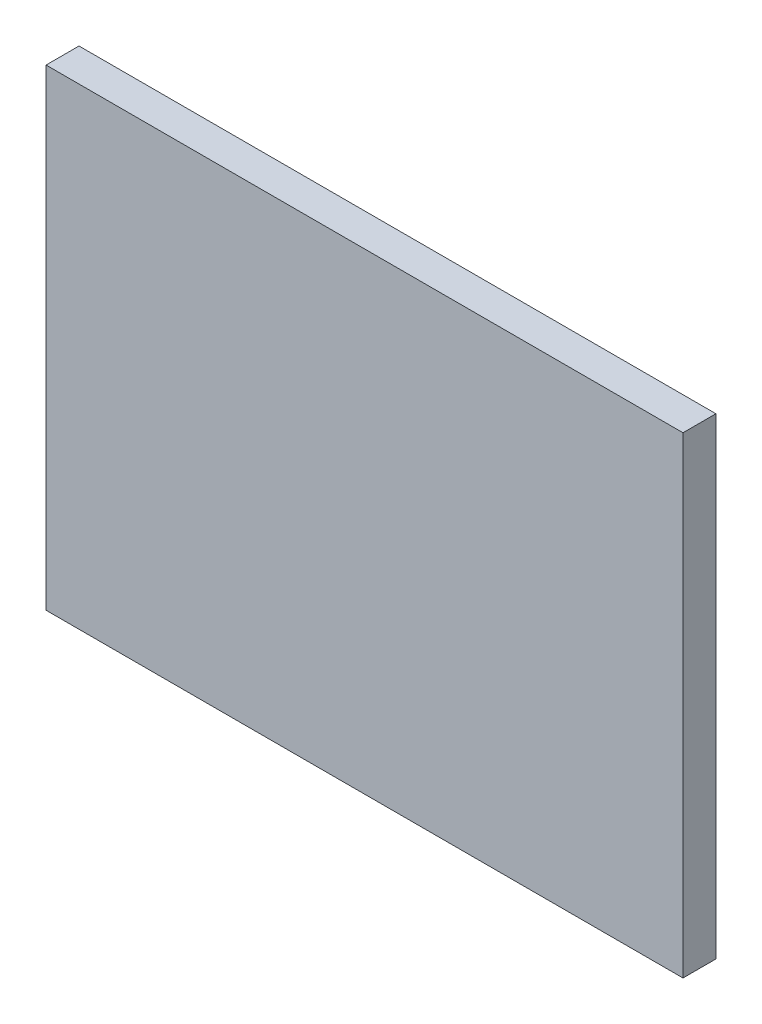
from build123d import *

# Parameters (mm, degrees)
SKETCH1_W           = 58
SKETCH1_H           = 43
BOSS_EXTRUDE1_DEPTH = 3


with BuildPart() as part:
    # Sketch1 → Boss-Extrude1 (new body)
    with BuildSketch(Plane.XY):
        with Locations((-18.971007556, 1.051687415)):
            Rectangle(SKETCH1_W, SKETCH1_H)
    extrude(amount=BOSS_EXTRUDE1_DEPTH)


solid = part.part
